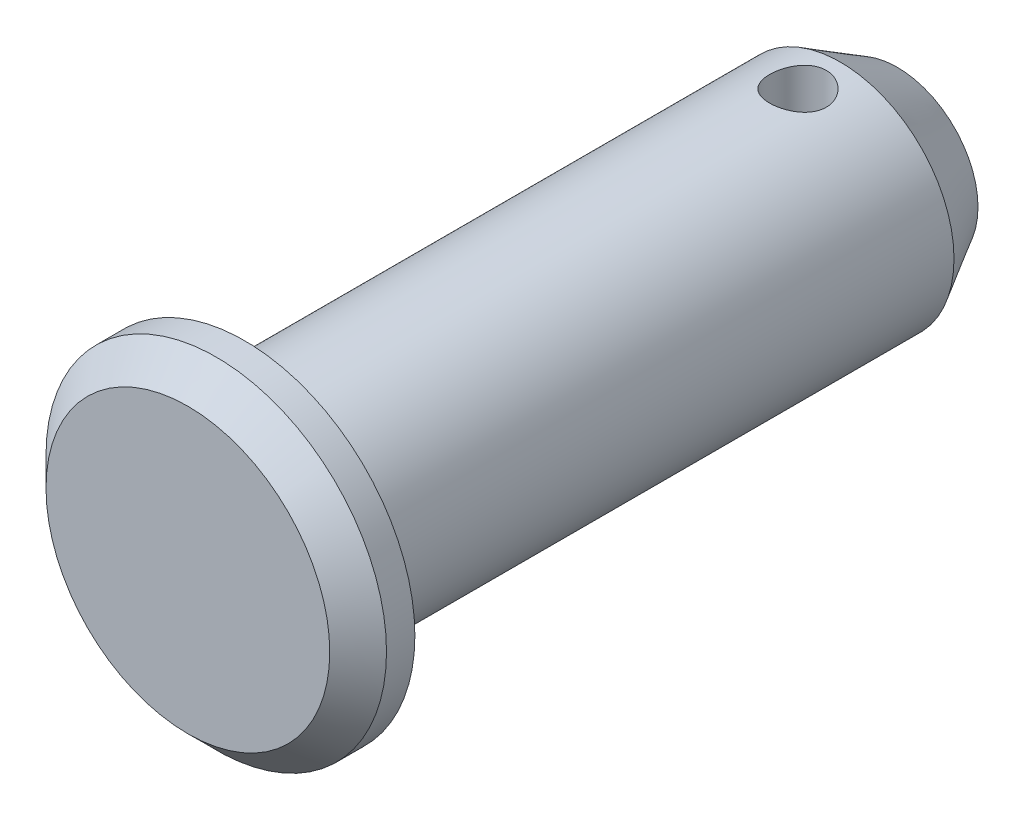
from build123d import *

# Parameters (mm, degrees)
WYTNIJ_WYCI_GNI_CIE1_DEPTH      = 16.10794493
WYTNIJ_WYCI_GNI_CIE1_DEPTH_BACK = 16.10794493
SZKIC2_R                        = 1


with BuildPart() as part:
    # Szkic1 → Obrót1 (revolve)
    with BuildSketch(Plane(origin=(0, 0, 0), x_dir=(1, 0, 0), z_dir=(0, 1, 0))):
        Polygon((0, -12.5), (5, -12.5), (6, -11.5), (6, -10.5), (4, -10.5), (4, 10.5), (2.845299462, 12.5), (0, 12.5), align=None)
    revolve(axis=Axis((0, 0, 12.5), (0, 0, -1)))

    # Szkic2 → Wytnij-wyciągnięcie1 (cut, two sides: drawn at the far end of the back side and taken through both)
    with BuildSketch(Plane(origin=(0, 0, 0), x_dir=(1, 0, 0), z_dir=(0, 1, 0)).offset(-WYTNIJ_WYCI_GNI_CIE1_DEPTH_BACK)):
        with Locations(Location((0, 9, 0), (0, 0, 270))):
            Circle(SZKIC2_R)
    extrude(amount=WYTNIJ_WYCI_GNI_CIE1_DEPTH + WYTNIJ_WYCI_GNI_CIE1_DEPTH_BACK, mode=Mode.SUBTRACT)


solid = part.part
